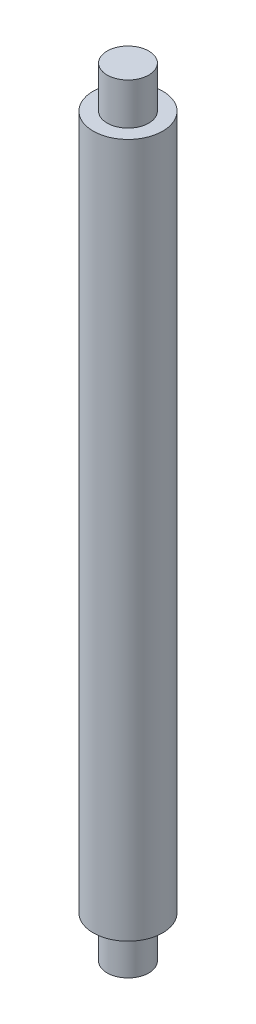
from build123d import *

# Parameters (mm, degrees)
SKETCH_1_R      = 2.5
EXTRUDE_2_DEPTH = 25
SKETCH_2_R      = 1.5
EXTRUDE_3_DEPTH = 3
EXTRUDE_START   = 3
SKETCH_3_R      = 1.5
EXTRUDE_4_DEPTH = 3


with BuildPart() as part:
    # 草图1 → 凸台-拉伸2 (new, symmetric)
    with BuildSketch(Plane(origin=(0, 0, 0), x_dir=(1, 0, 0), z_dir=(0, 1, 0))):
        with Locations(Location((0, 0, 0), (0, 0, 270))):
            Circle(SKETCH_1_R)
    extrude(amount=EXTRUDE_2_DEPTH, both=True)

    # 草图2 → 凸台-拉伸3 (add)
    with BuildSketch(Plane(origin=(0, 25, 0), x_dir=(1, 0, 0), z_dir=(0, 1, 0))):
        with Locations(Location((0, 0, 0), (0, 0, 270))):
            Circle(SKETCH_2_R)
    extrude(amount=EXTRUDE_3_DEPTH)

    # 草图3 → 凸台-拉伸4 (add)
    with BuildSketch(Plane.XZ.offset(25).offset(EXTRUDE_START)):
        with Locations(Location((0, 0, 0), (0, 0, 90))):
            Circle(SKETCH_3_R)
    extrude(amount=-EXTRUDE_4_DEPTH)


solid = part.part
